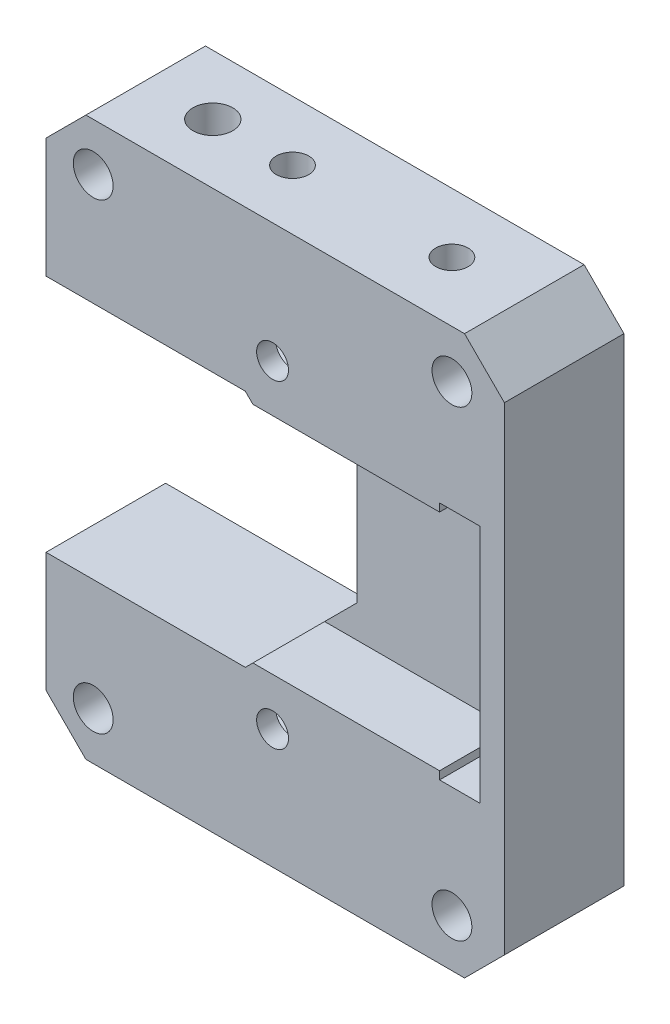
from build123d import *

# Parameters (mm, degrees)
EXTRUDE_2_DEPTH          = 15
CHAMFER_1_SIZE           = 5
CUT_EXTRUDE_START        = -13.418191
SKETCH_16_W              = 10.2
SKETCH_16_H              = 5.2
CUT_EXTRUDE_11_DEPTH     = 13.418191
SKETCH_17_W              = 10.2
SKETCH_17_H              = 5.2
CUT_EXTRUDE_12_DEPTH     = 15
SKETCH_19_R              = 2
CUT_EXTRUDE_13_DEPTH     = 83.70568747
CUT_EXTRUDE_14_REACH     = 104.544
SKETCH_21_R              = 2.5
SKETCH_24_R              = 2.032005788
CUT_EXTRUDE_16_DEPTH     = 10
PATTERN_LINEAR_1_COUNT   = 2
PATTERN_LINEAR_1_PITCH   = 20
CUT_EXTRUDE_20_REACH     = 84.706
SKETCH_31_R              = 2.5
MIRROR_1_COPY_1_SKETCH_R = 2.032005788
MIRROR_1_COPY_1_DEPTH    = 10
SKETCH_28_W              = 5.1
SKETCH_28_H              = 30.1
CUT_EXTRUDE_18_DEPTH     = 10
SKETCH_29_W              = 33.808551472
SKETCH_29_H              = 28.1
CUT_EXTRUDE_19_DEPTH     = 9


with BuildPart() as part:
    # 草圖1 → 填料-伸長2 (new body)
    with BuildSketch(Plane.XY):
        Polygon((-15.918190797, 35), (-73.418190797, 35), (-73.418190797, 15), (-43.418190797, 15), (-43.418190797, -15), (-73.418190797, -15), (-73.418190797, -35), (-15.918190797, -35), align=None)
    extrude(amount=EXTRUDE_2_DEPTH)

    # 導角1
    chamfer_1_edges = [part.edges().sort_by_distance(p)[0] for p in [
        (-73.418190797, 35, 7.5),
        (-15.918190797, 35, 7.5),
        (-15.918190797, -35, 7.5),
        (-73.418190797, -35, 7.5),
        (-43.418190797, -15, 7.5),
        (-43.418190797, 15, 7.5),
    ]]
    chamfer(chamfer_1_edges, length=CHAMFER_1_SIZE)

    # 草圖16 → 除料-伸長11 (cut)
    with BuildSketch(Plane.ZY.offset(73.418190797).offset(CUT_EXTRUDE_START)):
        with Locations((7.5, 20)):
            Rectangle(SKETCH_16_W, SKETCH_16_H)
    cut_extrude_11 = extrude(amount=CUT_EXTRUDE_11_DEPTH, mode=Mode.SUBTRACT)

    # 草圖17 → 除料-伸長12 (cut)
    with BuildSketch(Plane(origin=(-60, 0, 0), x_dir=(0, 0, -1), z_dir=(1, 0, 0))):
        with Locations((-7.5, 20)):
            Rectangle(SKETCH_17_W, SKETCH_17_H)
    cut_extrude_12 = extrude(amount=CUT_EXTRUDE_12_DEPTH, mode=Mode.SUBTRACT)

    # 草圖19 → 除料-伸長13 (cut, through all)
    with BuildSketch(Plane.XY.offset(15)):
        with Locations((-45, 20)):
            Circle(SKETCH_19_R)
    cut_extrude_13 = extrude(amount=-CUT_EXTRUDE_13_DEPTH, mode=Mode.SUBTRACT)

    # 草圖21 → 除料-伸長14 (cut, up to next)
    with BuildSketch(Plane(origin=(0, 35, 0), x_dir=(1, 0, 0), z_dir=(0, 1, 0)), mode=Mode.PRIVATE) as cut_extrude_14_sk1:
        with Locations(Location((-60, -7.5, 0), (0, 0, 270))):
            Circle(SKETCH_21_R)
    cut_extrude_14_tool1 = extrude(cut_extrude_14_sk1.sketch, amount=-CUT_EXTRUDE_14_REACH, mode=Mode.PRIVATE) & part.part
    cut_extrude_14 = cut_extrude_14_tool1.solids().sort_by_distance((-60, 35, 7.5))[0]
    add(cut_extrude_14, mode=Mode.SUBTRACT)

    # 草圖24 → 除料-伸長16 (cut)
    with BuildSketch(Plane(origin=(0, 35, 0), x_dir=(1, 0, 0), z_dir=(0, 1, 0))):
        with Locations(Location((-50, -7.5, 0), (0, 0, 270))):
            Circle(SKETCH_24_R)
    cut_extrude_16 = extrude(amount=-CUT_EXTRUDE_16_DEPTH, mode=Mode.SUBTRACT)

    # 直線複製排列1: 除料-伸長16 ×2
    with Locations(*[(i * PATTERN_LINEAR_1_PITCH, 0, 0) for i in range(1, PATTERN_LINEAR_1_COUNT)]):
        add(cut_extrude_16, mode=Mode.SUBTRACT)

    # 草圖31 → 除料-伸長20 (cut, up to next)
    with BuildSketch(Plane.XY.offset(15), mode=Mode.PRIVATE) as cut_extrude_20_sk1:
        with Locations((-22.5, 29)):
            Circle(SKETCH_31_R)
    cut_extrude_20_tool1 = extrude(cut_extrude_20_sk1.sketch, amount=-CUT_EXTRUDE_20_REACH, mode=Mode.PRIVATE) & part.part
    # 草圖31 → 除料-伸長20 (cut, up to next)
    with BuildSketch(Plane.XY.offset(15), mode=Mode.PRIVATE) as cut_extrude_20_sk2:
        with Locations((-67.5, 29)):
            Circle(SKETCH_31_R)
    cut_extrude_20_tool2 = extrude(cut_extrude_20_sk2.sketch, amount=-CUT_EXTRUDE_20_REACH, mode=Mode.PRIVATE) & part.part
    cut_extrude_20_1 = cut_extrude_20_tool1.solids().sort_by_distance((-22.5, 29, 15))[0]
    add(cut_extrude_20_1, mode=Mode.SUBTRACT)
    cut_extrude_20_2 = cut_extrude_20_tool2.solids().sort_by_distance((-67.5, 29, 15))[0]
    add(cut_extrude_20_2, mode=Mode.SUBTRACT)
    cut_extrude_20 = cut_extrude_20_1 + cut_extrude_20_2  # 除料-伸長20 as one shape, for the pattern or mirror that repeats it

    # 鏡射1: 除料-伸長11, 除料-伸長12, 除料-伸長13, 除料-伸長14, 除料-伸長16, 除料-伸長20 across plane
    add(cut_extrude_11.mirror(Plane.ZX), mode=Mode.SUBTRACT)
    add(cut_extrude_12.mirror(Plane.ZX), mode=Mode.SUBTRACT)
    add(cut_extrude_13.mirror(Plane.ZX), mode=Mode.SUBTRACT)
    add(cut_extrude_14.mirror(Plane.ZX), mode=Mode.SUBTRACT)
    add(cut_extrude_16.mirror(Plane.ZX), mode=Mode.SUBTRACT)
    add(cut_extrude_20.mirror(Plane.ZX), mode=Mode.SUBTRACT)

    # 鏡射1 copy 1 sketch → 鏡射1 copy 1 (cut)
    with BuildSketch(Plane(origin=(20, -35, 0), x_dir=(1, 0, 0), z_dir=(0, -1, 0))):
        with Locations((-50, 7.5)):
            Circle(MIRROR_1_COPY_1_SKETCH_R)
    extrude(amount=-MIRROR_1_COPY_1_DEPTH, mode=Mode.SUBTRACT)

    # 草圖28 → 除料-伸長18 (cut)
    with BuildSketch(Plane.XY.offset(15)):
        with Locations((-21.502726402, 0)):
            Rectangle(SKETCH_28_W, SKETCH_28_H)
    extrude(amount=-CUT_EXTRUDE_18_DEPTH, mode=Mode.SUBTRACT)

    # 草圖29 → 除料-伸長19 (cut)
    with BuildSketch(Plane.XY.offset(15)):
        with Locations((-40.957002138, 0)):
            Rectangle(SKETCH_29_W, SKETCH_29_H)
    extrude(amount=-CUT_EXTRUDE_19_DEPTH, mode=Mode.SUBTRACT)


solid = part.part
